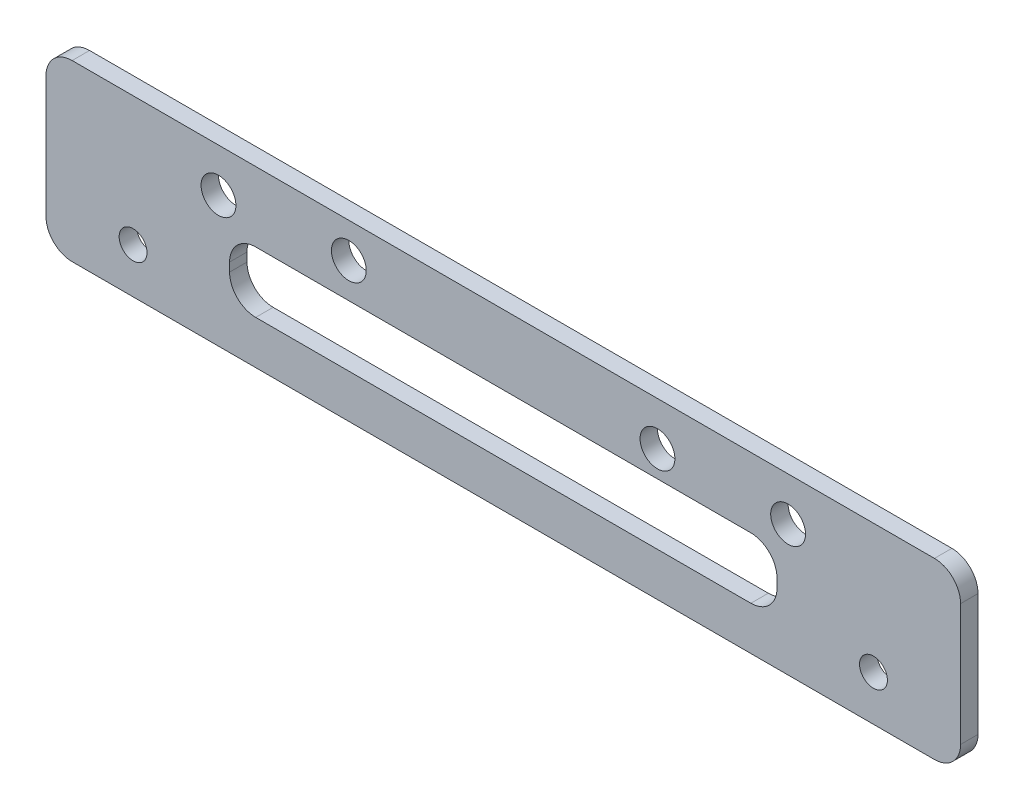
from build123d import *

# Parameters (mm, degrees)
SKETCH_1_W          = 105
SKETCH_1_H          = 20
EXTRUDE_1_DEPTH     = 2
FILLET_1_R          = 3
SKETCH_2_R          = 2
SKETCH_2_R_2        = 1.6
CUT_EXTRUDE_1_DEPTH = 3


with BuildPart() as part:
    # 草图1 → 凸台-拉伸1 (new body)
    with BuildSketch(Plane.XY):
        Rectangle(SKETCH_1_W, SKETCH_1_H)
    extrude(amount=EXTRUDE_1_DEPTH)

    # 圆角1
    fillet_1_edges = [part.edges().sort_by_distance(p)[0] for p in [
        (52.5, -10, 1),
        (-52.5, -10, 1),
        (-52.5, 10, 1),
        (52.5, 10, 1),
    ]]
    fillet(fillet_1_edges, radius=FILLET_1_R)

    # 草图2 → 切除-拉伸1 (cut)
    with BuildSketch(Plane.XY.offset(2)):
        with Locations((-32.7, 5)):
            Circle(SKETCH_2_R)
        with Locations((-17.733222632, 5.997785158)):
            Circle(SKETCH_2_R)
        with Locations((17.7, 5)):
            Circle(SKETCH_2_R)
        with Locations((32.7, 5)):
            Circle(SKETCH_2_R)
        with Locations((42.5, -4.815743551)):
            Circle(SKETCH_2_R_2)
        with Locations((-42.5, -4.815743551)):
            Circle(SKETCH_2_R_2)
        with BuildLine():
            Line((-28.423476114, 2), (28.423476114, 2))
            ThreePointArc((28.423476114, 2), (30.544796458, 1.121320344), (31.423476114, -1))
            Line((31.423476114, -1), (31.423476114, -2))
            ThreePointArc((31.423476114, -2), (30.544796458, -4.121320344), (28.423476114, -5))
            Line((28.423476114, -5), (-28.423476114, -5))
            ThreePointArc((-28.423476114, -5), (-30.544796458, -4.121320344), (-31.423476114, -2))
            Line((-31.423476114, -2), (-31.423476114, -1))
            ThreePointArc((-31.423476114, -1), (-30.544796458, 1.121320344), (-28.423476114, 2))
        make_face()
    extrude(amount=-CUT_EXTRUDE_1_DEPTH, mode=Mode.SUBTRACT)


solid = part.part
